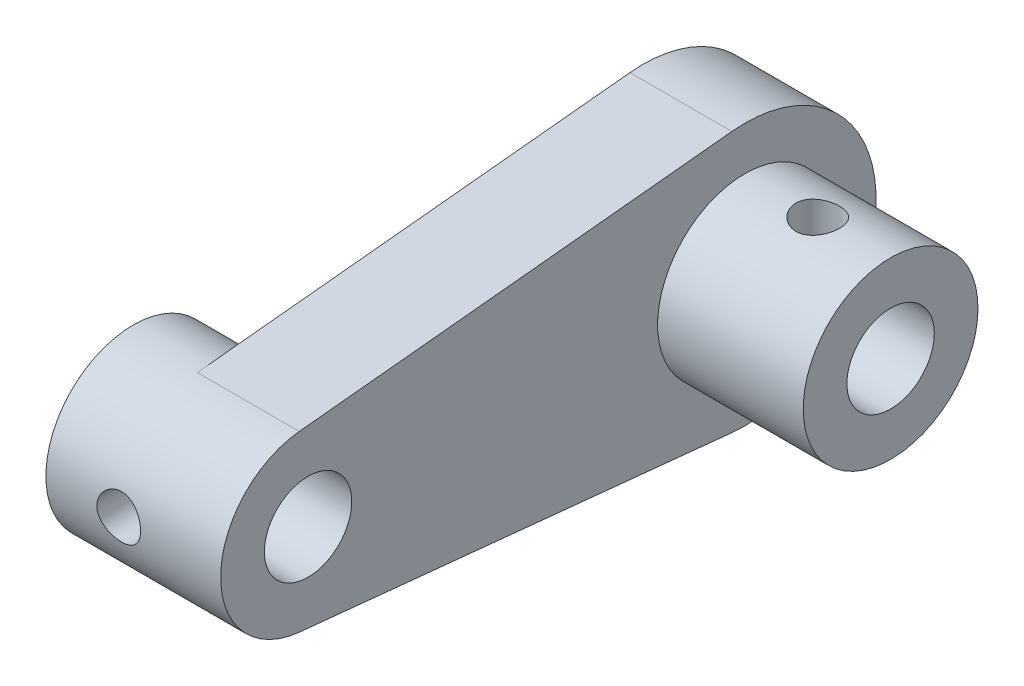
from build123d import *

# Parameters (mm, degrees)
SKETCH1_R               = 3
BOSS_EXTRUDE1_DEPTH     = 7
BOSS_EXTRUDE2_START     = -12
SKETCH2_R               = 3
BOSS_EXTRUDE2_DEPTH     = 12
SKETCH2_4_R             = 6
SKETCH2_4_R_2           = 3
BOSS_EXTRUDE3_DEPTH     = 10
CUT_EXTRUDE1_DEPTH      = 41.816663264
CUT_EXTRUDE1_DEPTH_BACK = 41.816663264
SKETCH4_R               = 1.5
SKETCH6_R               = 1.5
CUT_EXTRUDE2_DEPTH      = 44.485629849


with BuildPart() as part:
    # Sketch1 → Boss-Extrude1 (new body)
    with BuildSketch(Plane.YZ):
        with BuildLine():
            Line((-5.969924623, 30.6), (-8.954886934, 0.9))
            ThreePointArc((-8.954886934, 0.9), (0, -9), (8.954886934, 0.9))
            Line((8.954886934, 0.9), (5.969924623, 30.6))
            ThreePointArc((5.969924623, 30.6), (0, 36), (-5.969924623, 30.6))
        make_face()
        Circle(SKETCH1_R, mode=Mode.SUBTRACT)
        with Locations((0, 30)):
            Circle(SKETCH1_R, mode=Mode.SUBTRACT)
    extrude(amount=BOSS_EXTRUDE1_DEPTH)

    # Sketch2 → Boss-Extrude2 (add)
    with BuildSketch(Plane.YZ.offset(7).offset(BOSS_EXTRUDE2_START)):
        with BuildLine():
            ThreePointArc((-5.969924623, 30.6), (-0.30037665, 24.007523561), (6, 30))
            ThreePointArc((6, 30), (5.992476439, 30.30037665), (5.969924623, 30.6))
            ThreePointArc((5.969924623, 30.6), (0, 36), (-5.969924623, 30.6))
        make_face()
        with Locations((0, 30)):
            Circle(SKETCH2_R, mode=Mode.SUBTRACT)
    extrude(amount=BOSS_EXTRUDE2_DEPTH)

    # Sketch2<4> → Boss-Extrude3 (add)
    with BuildSketch(Plane.YZ.offset(7)):
        Circle(SKETCH2_4_R)
        Circle(SKETCH2_4_R_2, mode=Mode.SUBTRACT)
    extrude(amount=BOSS_EXTRUDE3_DEPTH)

    # Sketch4 → Cut-Extrude1 (cut, two sides: drawn at the far end of the back side and taken through both)
    with BuildSketch(Plane(origin=(0, 0, 0), x_dir=(-1, 0, 0), z_dir=(0, 1, 0)).offset(-CUT_EXTRUDE1_DEPTH_BACK)):
        with Locations((-12, 0)):
            Circle(SKETCH4_R)
    extrude(amount=CUT_EXTRUDE1_DEPTH + CUT_EXTRUDE1_DEPTH_BACK, mode=Mode.SUBTRACT)

    # Sketch6 → Cut-Extrude2 (cut, through all)
    with BuildSketch(Plane(origin=(0, 0, 30), x_dir=(0, 1, 0), z_dir=(0, 0, 1))):
        Circle(SKETCH6_R)
    extrude(amount=CUT_EXTRUDE2_DEPTH, mode=Mode.SUBTRACT)


solid = part.part
